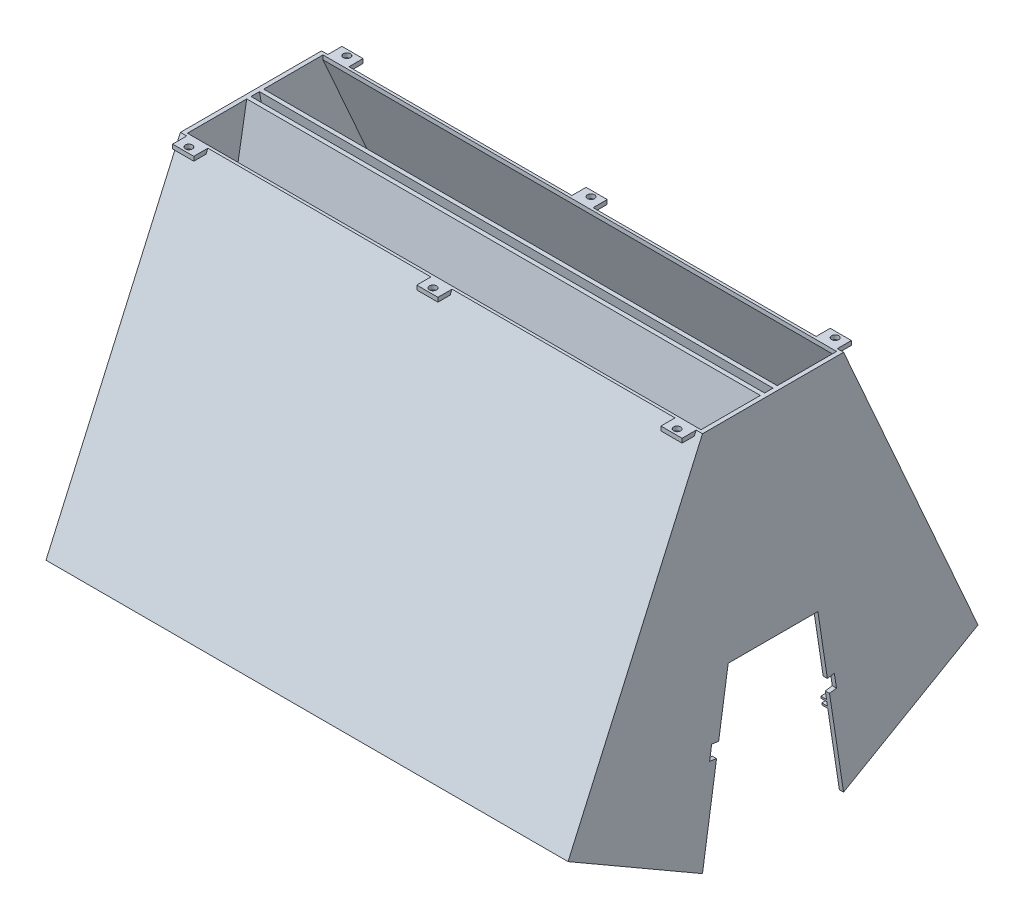
from build123d import *

# Parameters (mm, degrees)
BOSS_EXTRUDE1_DEPTH = 370
SHELL1_T            = -3
SKETCH4_W           = 364
SKETCH4_H           = 96.095905324
CUT_EXTRUDE2_DEPTH  = 497.302890263
BOSS_EXTRUDE2_REACH = 497.698
SKETCH9_W           = 15
SKETCH9_H           = 10
SKETCH9_R           = 2.5
BOSS_EXTRUDE4_DEPTH = 3
BOSS_EXTRUDE5_DEPTH = 4
BOSS_EXTRUDE6_DEPTH = 4
CUT_EXTRUDE3_DEPTH  = 498.923245976


with BuildPart() as part:
    # Sketch2 → Boss-Extrude1 (new body)
    with BuildSketch(Plane(origin=(0, 0, 0), x_dir=(0, 0, -1), z_dir=(1, 0, 0))):
        Polygon((100, 0), (195.262794416, 55), (100, 270), (0, 270), (-95.262794416, 55), (0, 0), (18.222222222, 120), (81.777777778, 120), align=None)
    extrude(amount=BOSS_EXTRUDE1_DEPTH)

    # Shell1
    shell1_openings = [part.faces().sort_by_distance(p)[0] for p in [
        (185, 27.5, 47.631397208),
        (185, 27.5, -147.631397208),
        (185, 60, -90.888888889),
        (185, 120, -50),
        (185, 60, -9.111111111),
    ]]
    offset(amount=SHELL1_T, openings=shell1_openings, kind=Kind.INTERSECTION)

    # Sketch4 → Cut-Extrude2 (cut, through all)
    with BuildSketch(Plane.XZ.offset(-267)):
        with Locations((185, -50)):
            Rectangle(SKETCH4_W, SKETCH4_H)
    extrude(amount=-CUT_EXTRUDE2_DEPTH, mode=Mode.SUBTRACT)

    # Sketch5 → Boss-Extrude2 (add, up to next)
    with BuildSketch(Plane(origin=(3, 0, 0), x_dir=(0, 0, -1), z_dir=(1, 0, 0)), mode=Mode.PRIVATE) as boss_extrude2_sk1:
        Polygon((47, 270), (44, 270), (18.222222222, 120), (21.222222222, 120), align=None)
    boss_extrude2_tool1 = extrude(boss_extrude2_sk1.sketch, amount=BOSS_EXTRUDE2_REACH, mode=Mode.PRIVATE) - part.part
    # Sketch5 → Boss-Extrude2 (add, up to next)
    with BuildSketch(Plane(origin=(3, 0, 0), x_dir=(0, 0, -1), z_dir=(1, 0, 0)), mode=Mode.PRIVATE) as boss_extrude2_sk2:
        Polygon((53, 270), (56, 270), (81.777777778, 120), (78.777777778, 120), align=None)
    boss_extrude2_tool2 = extrude(boss_extrude2_sk2.sketch, amount=BOSS_EXTRUDE2_REACH, mode=Mode.PRIVATE) - part.part
    add(boss_extrude2_tool1.solids().sort_by_distance((3, 195, -32.611111))[0])
    add(boss_extrude2_tool2.solids().sort_by_distance((3, 195, -67.388889))[0])

    # Sketch9 → Boss-Extrude4 (add)
    # profile 1 of 6: a face of its own
    with BuildSketch(Plane(origin=(0, 267, 0), x_dir=(1, 0, 0), z_dir=(0, 1, 0))):
        with Locations((11.965, 105)):
            Rectangle(SKETCH9_W, SKETCH9_H)
        with Locations(Location((11.965, 106, 0), (0, 0, 270))):
            Circle(SKETCH9_R, mode=Mode.SUBTRACT)
    # profile 2 of 6: a face of its own
    with BuildSketch(Plane(origin=(0, 267, 0), x_dir=(1, 0, 0), z_dir=(0, 1, 0))):
        with Locations((185.002, 105)):
            Rectangle(SKETCH9_W, SKETCH9_H)
        with Locations(Location((185.002, 106, 0), (0, 0, 270))):
            Circle(SKETCH9_R, mode=Mode.SUBTRACT)
    # profile 3 of 6: a face of its own
    with BuildSketch(Plane(origin=(0, 267, 0), x_dir=(1, 0, 0), z_dir=(0, 1, 0))):
        with Locations((358.035, 105)):
            Rectangle(SKETCH9_W, SKETCH9_H)
        with Locations(Location((358.035, 106, 0), (0, 0, 270))):
            Circle(SKETCH9_R, mode=Mode.SUBTRACT)
    # profile 4 of 6: a face of its own
    with BuildSketch(Plane(origin=(0, 267, 0), x_dir=(1, 0, 0), z_dir=(0, 1, 0))):
        with Locations((358.035, -5)):
            Rectangle(SKETCH9_W, SKETCH9_H)
        with Locations(Location((358.035, -6, 0), (0, 0, 270))):
            Circle(SKETCH9_R, mode=Mode.SUBTRACT)
    # profile 5 of 6: a face of its own
    with BuildSketch(Plane(origin=(0, 267, 0), x_dir=(1, 0, 0), z_dir=(0, 1, 0))):
        with Locations((185.002, -5)):
            Rectangle(SKETCH9_W, SKETCH9_H)
        with Locations(Location((185.002, -6, 0), (0, 0, 270))):
            Circle(SKETCH9_R, mode=Mode.SUBTRACT)
    # profile 6 of 6: a face of its own
    with BuildSketch(Plane(origin=(0, 267, 0), x_dir=(1, 0, 0), z_dir=(0, 1, 0))):
        with Locations((11.965, -5)):
            Rectangle(SKETCH9_W, SKETCH9_H)
        with Locations(Location((11.965, -6, 0), (0, 0, 270))):
            Circle(SKETCH9_R, mode=Mode.SUBTRACT)
    extrude(amount=BOSS_EXTRUDE4_DEPTH)

    # Sketch11 → Boss-Extrude5 (add)
    with BuildSketch(Plane.ZY.offset(-367)):
        Polygon((-9.111111111, 60), (-8.883333333, 58.5), (92.396882217, 61.468119339), (91.789234305, 62.839528838), align=None)
        Polygon((94.383691773, 56.984059669), (93.719067626, 58.484059669), (-8.433126527, 55.535223468), (-8.205348749, 54.035223468), align=None)
        Polygon((-191.789234305, 62.839528838), (-90.888888889, 60), (-91.116666667, 58.5), (-192.396882217, 61.468119339), align=None)
        Polygon((-194.383691773, 56.984059669), (-193.719067625, 58.484059669), (-91.566873473, 55.535223468), (-91.794651251, 54.035223468), align=None)
    extrude(amount=BOSS_EXTRUDE5_DEPTH)

    # Sketch10 → Boss-Extrude6 (add)
    with BuildSketch(Plane(origin=(3, 0, 0), x_dir=(0, 0, -1), z_dir=(1, 0, 0))):
        Polygon((9.111111111, 60), (-91.789234305, 62.839528838), (-92.396882217, 61.468119339), (8.883333333, 58.5), align=None)
        Polygon((-93.719067626, 58.484059669), (8.433126527, 55.535223468), (8.205348749, 54.035223468), (-94.383691773, 56.984059669), align=None)
        Polygon((194.383691773, 56.984059669), (193.719067625, 58.484059669), (91.566873473, 55.535223468), (91.794651251, 54.035223468), align=None)
        Polygon((192.396882217, 61.468119339), (91.116666667, 58.5), (90.888888889, 60), (191.789234305, 62.839528838), align=None)
    extrude(amount=BOSS_EXTRUDE6_DEPTH)

    # Sketch12 → Cut-Extrude3 (cut, through all)
    with BuildSketch(Plane(origin=(370, 0, 0), x_dir=(0, 0, -1), z_dir=(1, 0, 0))):
        Polygon((11.466336894, 75.51002345), (6.523006166, 76.260677375), (5.021698316, 66.37401592), (9.965029044, 65.623361994), (10.715682969, 70.566692722), align=None)
        Polygon((89.284317031, 70.566692722), (88.533663106, 75.51002345), (93.476993834, 76.260677375), (94.978301684, 66.37401592), (90.034970956, 65.623361994), align=None)
    extrude(amount=-CUT_EXTRUDE3_DEPTH, mode=Mode.SUBTRACT)


solid = part.part
